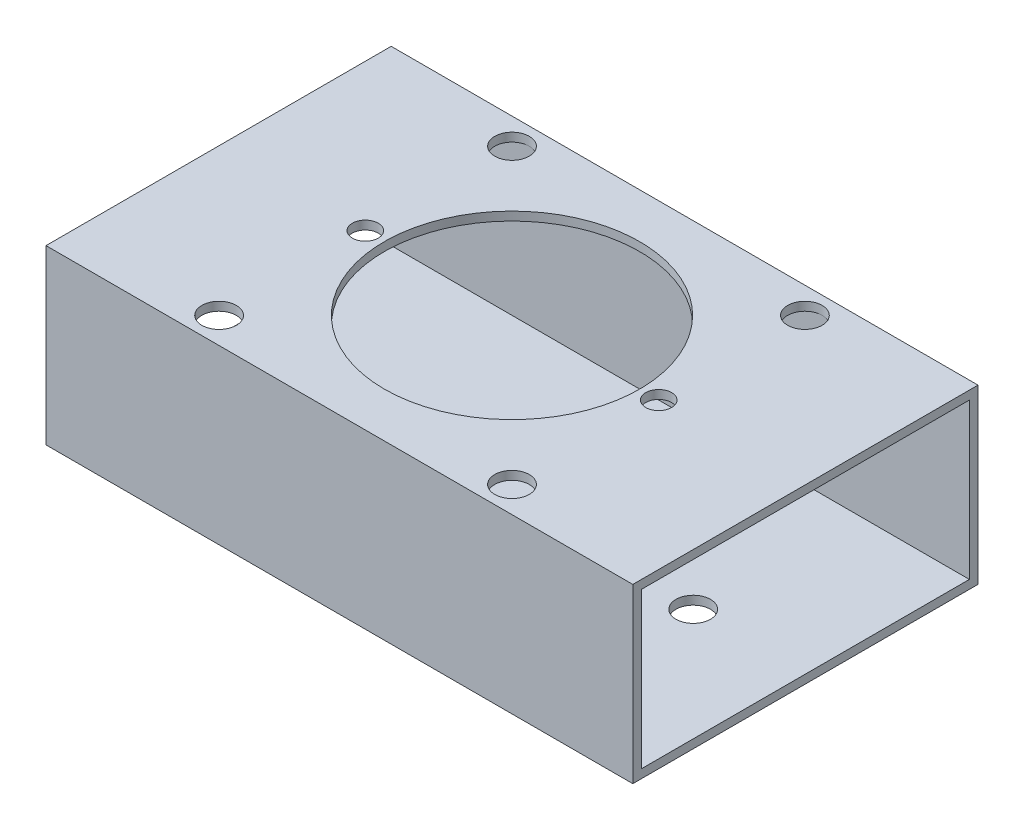
from build123d import *

# Parameters (mm, degrees)
SKETCH_1_W          = 68
SKETCH_1_H          = 40
EXTRUDE_1_DEPTH     = 20
SKETCH_2_W          = 38
SKETCH_2_H          = 18
CUT_EXTRUDE_1_DEPTH = 74.647810558
SKETCH_3_R          = 2
CUT_EXTRUDE_2_DEPTH = 1
SKETCH_4_R          = 14.8
SKETCH_4_R_2        = 1.5
CUT_EXTRUDE_3_DEPTH = 1
MM_PRESS_1_D        = 4
MM_PRESS_1_DEPTH    = 1
MM_PRESS_1_TIP      = 1.201721238


with BuildPart() as part:
    # 草图1 → 凸台-拉伸1 (new body)
    with BuildSketch(Plane(origin=(0, 0, 0), x_dir=(1, 0, 0), z_dir=(0, 1, 0))):
        Rectangle(SKETCH_1_W, SKETCH_1_H)
    extrude(amount=EXTRUDE_1_DEPTH)

    # 草图2 → 切除-拉伸1 (cut, through all)
    with BuildSketch(Plane(origin=(34, 0, 0), x_dir=(0, 0, -1), z_dir=(1, 0, 0))):
        with Locations((0, 10)):
            Rectangle(SKETCH_2_W, SKETCH_2_H)
    extrude(amount=-CUT_EXTRUDE_1_DEPTH, mode=Mode.SUBTRACT)

    # 草图3 → 切除-拉伸2 (cut)
    with BuildSketch(Plane.XZ):
        with Locations(Location((-21, 0, 0), (0, 0, 270))):
            Circle(SKETCH_3_R)
        with Locations(Location((21, 0, 0), (0, 0, 270))):
            Circle(SKETCH_3_R)
    extrude(amount=-CUT_EXTRUDE_2_DEPTH, mode=Mode.SUBTRACT)

    # 草图4 → 切除-拉伸3 (cut)
    with BuildSketch(Plane(origin=(0, 20, 0), x_dir=(1, 0, 0), z_dir=(0, 1, 0))):
        with Locations(Location((0, 0, 0), (0, 0, 270))):
            Circle(SKETCH_4_R)
        with Locations(Location((-17, 0, 0), (0, 0, 270))):
            Circle(SKETCH_4_R_2)
        with Locations(Location((17, 0, 0), (0, 0, 270))):
            Circle(SKETCH_4_R_2)
    extrude(amount=-CUT_EXTRUDE_3_DEPTH, mode=Mode.SUBTRACT)

    # 大小mm Press 暗销孔1
    with Locations(Plane(origin=(16.970562748, 20, 16.970562748), x_dir=(0, 0, 1), z_dir=(0, 1, 0))):
        with Locations((0, 0), (0, -33.941125496), (-33.941125496, -33.941125496), (-33.941125496, 0)):
            Hole(MM_PRESS_1_D / 2, depth=MM_PRESS_1_DEPTH)
            with Locations((0, 0, -(MM_PRESS_1_DEPTH + MM_PRESS_1_TIP / 2))):  # 118° drill point
                Cone(0, MM_PRESS_1_D / 2, MM_PRESS_1_TIP, mode=Mode.SUBTRACT)


solid = part.part
